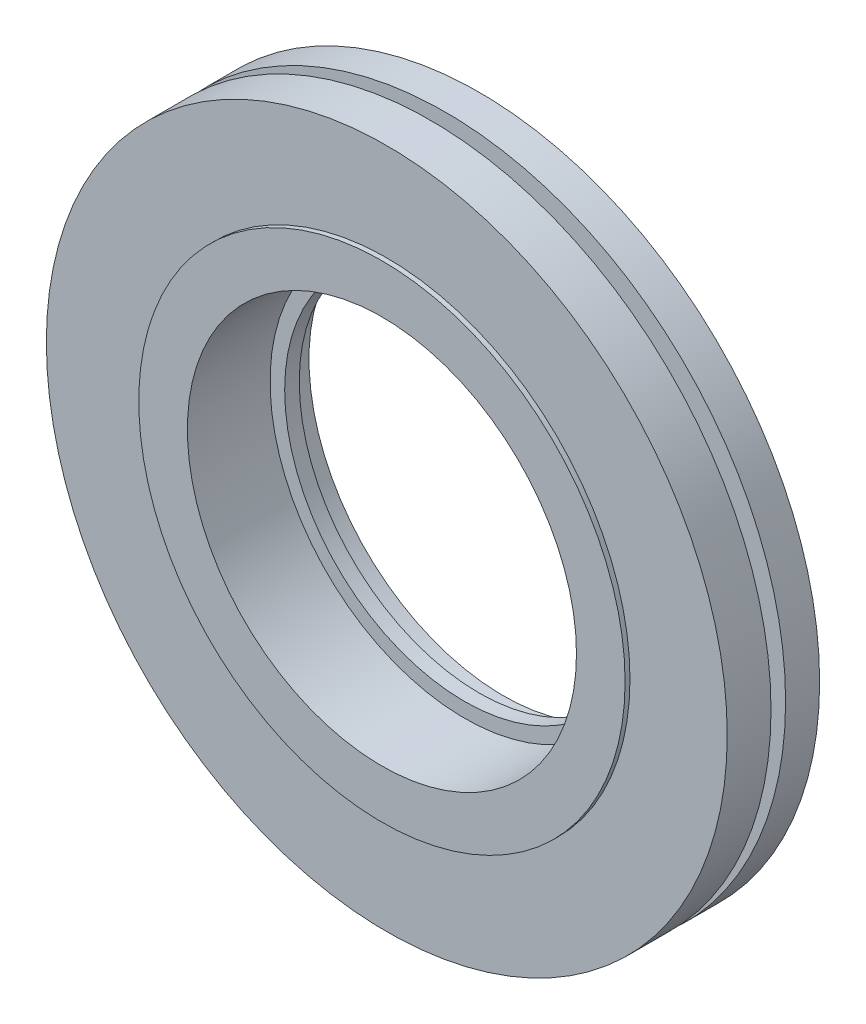
from build123d import *

# Parameters (mm, degrees)
D10_PILOT_AND_M10X0P5_THREAD_ENVELOPE_START = 1
SKETCH1_R                                   = 5
SKETCH1_R_2                                 = 4
D10_PILOT_AND_M10X0P5_THREAD_ENVELOPE_DEPTH = 2.5
OUTER_RACE_INNER_SHOULDER_ID7P4_START       = 1.5
SKETCH2_R                                   = 5
SKETCH2_R_2                                 = 3.7
OUTER_RACE_INNER_SHOULDER_ID7P4_DEPTH       = 0.3
INBOARD_G10_RETENTION_FLANGE_H0P3_START     = 1.5
SKETCH3_R                                   = 7
SKETCH3_R_2                                 = 3.7
INBOARD_G10_RETENTION_FLANGE_H0P3_DEPTH     = 0.3
M14X0P5_BEARING_CAP_BOSS_START              = 1.6
SKETCH4_R                                   = 7
SKETCH4_R_2                                 = 4
M14X0P5_BEARING_CAP_BOSS_DEPTH              = 0.6
FLANGED_RACE_POCKET_D9P6_START              = 2.5
SKETCH5_R                                   = 7
SKETCH5_R_2                                 = 4.8
FLANGED_RACE_POCKET_D9P6_DEPTH              = 0.9
SKETCH6_R                                   = 0.6
TWO_PIN_WRENCH_HOLES_D1P2_DEPTH             = 0.301


with BuildPart() as part:
    # Sketch1 → D10_Pilot_And_M10x0p5_Thread_Envelope (new body)
    with BuildSketch(Plane.XY.offset(D10_PILOT_AND_M10X0P5_THREAD_ENVELOPE_START)):
        Circle(SKETCH1_R)
        Circle(SKETCH1_R_2, mode=Mode.SUBTRACT)
    extrude(amount=D10_PILOT_AND_M10X0P5_THREAD_ENVELOPE_DEPTH)

    # Sketch2 → Outer_Race_Inner_Shoulder_ID7p4 (add)
    with BuildSketch(Plane.XY.offset(OUTER_RACE_INNER_SHOULDER_ID7P4_START)):
        Circle(SKETCH2_R)
        Circle(SKETCH2_R_2, mode=Mode.SUBTRACT)
    extrude(amount=OUTER_RACE_INNER_SHOULDER_ID7P4_DEPTH)

    # Sketch3 → Inboard_G10_Retention_Flange_H0p3 (add)
    with BuildSketch(Plane.XY.offset(INBOARD_G10_RETENTION_FLANGE_H0P3_START)):
        Circle(SKETCH3_R)
        Circle(SKETCH3_R_2, mode=Mode.SUBTRACT)
    extrude(amount=INBOARD_G10_RETENTION_FLANGE_H0P3_DEPTH)

    # Sketch4 → M14x0p5_Bearing_Cap_Boss (add)
    with BuildSketch(Plane.XY.offset(M14X0P5_BEARING_CAP_BOSS_START)):
        Circle(SKETCH4_R)
        Circle(SKETCH4_R_2, mode=Mode.SUBTRACT)
    extrude(amount=M14X0P5_BEARING_CAP_BOSS_DEPTH)

    # Sketch5 → Flanged_Race_Pocket_D9p6 (add)
    with BuildSketch(Plane.XY.offset(FLANGED_RACE_POCKET_D9P6_START)):
        Circle(SKETCH5_R)
        Circle(SKETCH5_R_2, mode=Mode.SUBTRACT)
    extrude(amount=FLANGED_RACE_POCKET_D9P6_DEPTH)

    # Sketch6 → Two_Pin_Wrench_Holes_D1p2 (cut)
    with BuildSketch(Plane.XY.offset(1.8)):
        with Locations((-6, 0)):
            Circle(SKETCH6_R)
        with Locations((6, 0)):
            Circle(SKETCH6_R)
    extrude(amount=-TWO_PIN_WRENCH_HOLES_D1P2_DEPTH, mode=Mode.SUBTRACT)


solid = part.part
